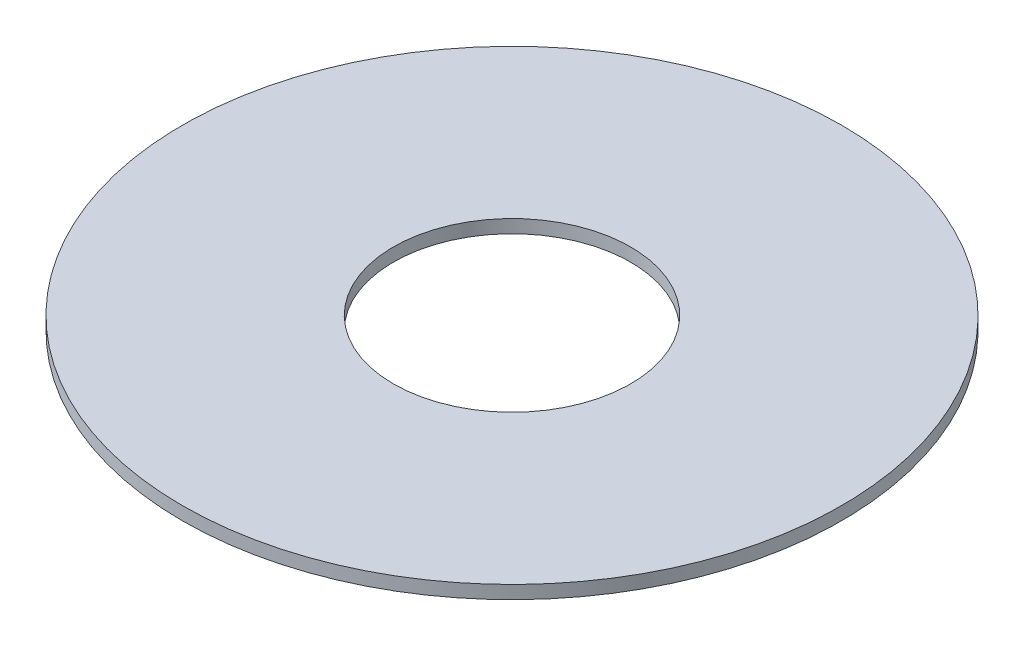
from build123d import *

# Parameters (mm, degrees)
SKETCH1_R           = 25
SKETCH1_R_2         = 9
BOSS_EXTRUDE1_DEPTH = 1


with BuildPart() as part:
    # Sketch1 → Boss-Extrude1 (new body)
    with BuildSketch(Plane(origin=(0, 0, 0), x_dir=(1, 0, 0), z_dir=(0, 1, 0))):
        with Locations(Location((0, 0, 0), (0, 0, 270))):
            Circle(SKETCH1_R)
        with Locations(Location((0, 0, 0), (0, 0, 270))):
            Circle(SKETCH1_R_2, mode=Mode.SUBTRACT)
    extrude(amount=BOSS_EXTRUDE1_DEPTH)


solid = part.part
